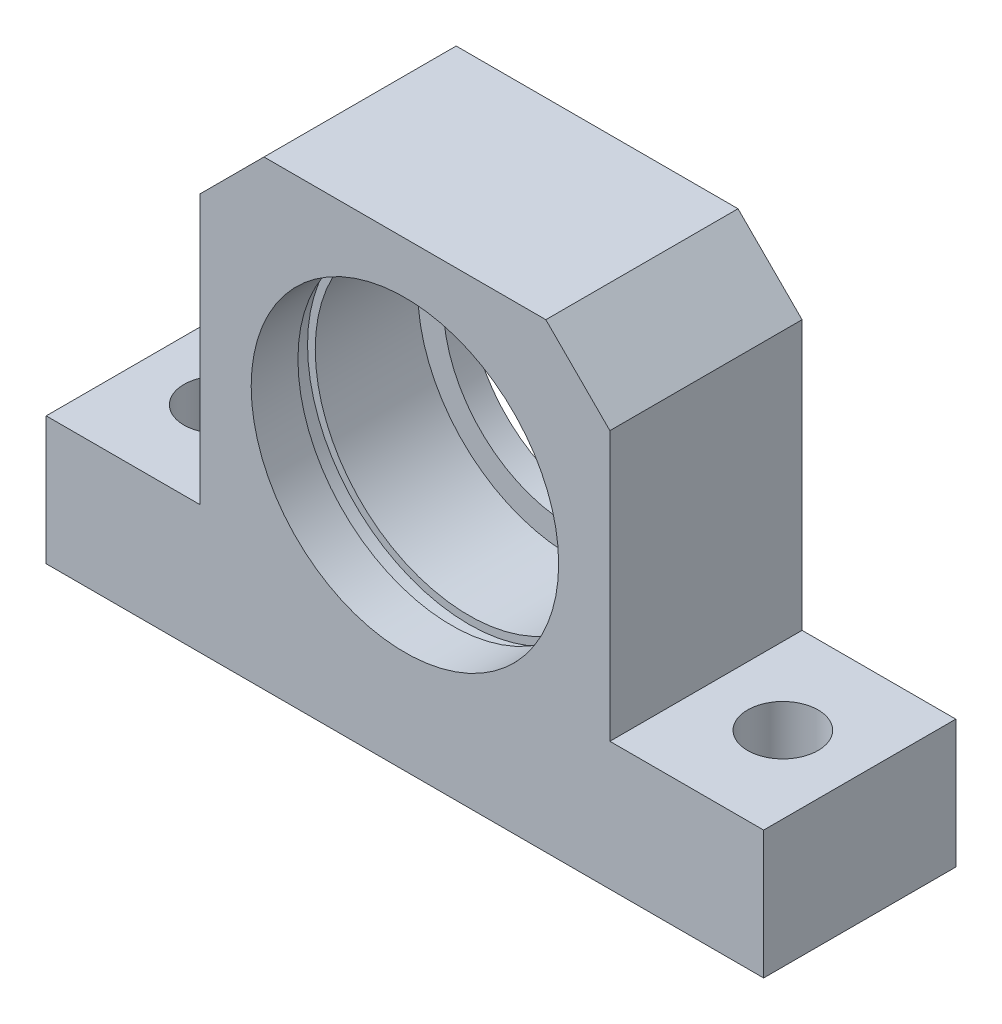
from build123d import *

# Parameters (mm, degrees)
BOSS_EXTRUDE1_DEPTH = 15
DIAMETER_HOLE1_D    = 5.5
CHAMFER1_SIZE       = 5


with BuildPart() as part:
    # Sketch1 → Boss-Extrude1 (new body)
    with BuildSketch(Plane.XY):
        Polygon((-16, 36), (16, 36), (16, 10), (28, 10), (28, 0), (-28, 0), (-28, 10), (-16, 10), align=None)
    extrude(amount=-BOSS_EXTRUDE1_DEPTH)

    # Sketch2 → Cut-Revolve1 (revolve, cut)
    with BuildSketch(Plane(origin=(0, 0, 0), x_dir=(0, 0, -1), z_dir=(1, 0, 0))):
        Polygon((3.65, 32), (3.65, 32.6), (5, 32.6), (5, 32), (13, 32), (13, 30), (15, 30), (15, 20), (0, 20), (0, 32), align=None)
    revolve(axis=Axis((0, 20, -15), (0, 0, 1)), mode=Mode.SUBTRACT)

    # Diameter Hole1 (through all)
    with Locations(Plane(origin=(0, 10, 0), x_dir=(1, 0, 0), z_dir=(0, 1, 0))):
        with Locations((-22, 7.5), (22, 7.5)):
            Hole(DIAMETER_HOLE1_D / 2)

    # Chamfer1
    chamfer1_edges = [part.edges().sort_by_distance(p)[0] for p in [
        (-16, 36, -7.5),
        (16, 36, -7.5),
    ]]
    chamfer(chamfer1_edges, length=CHAMFER1_SIZE)


solid = part.part
